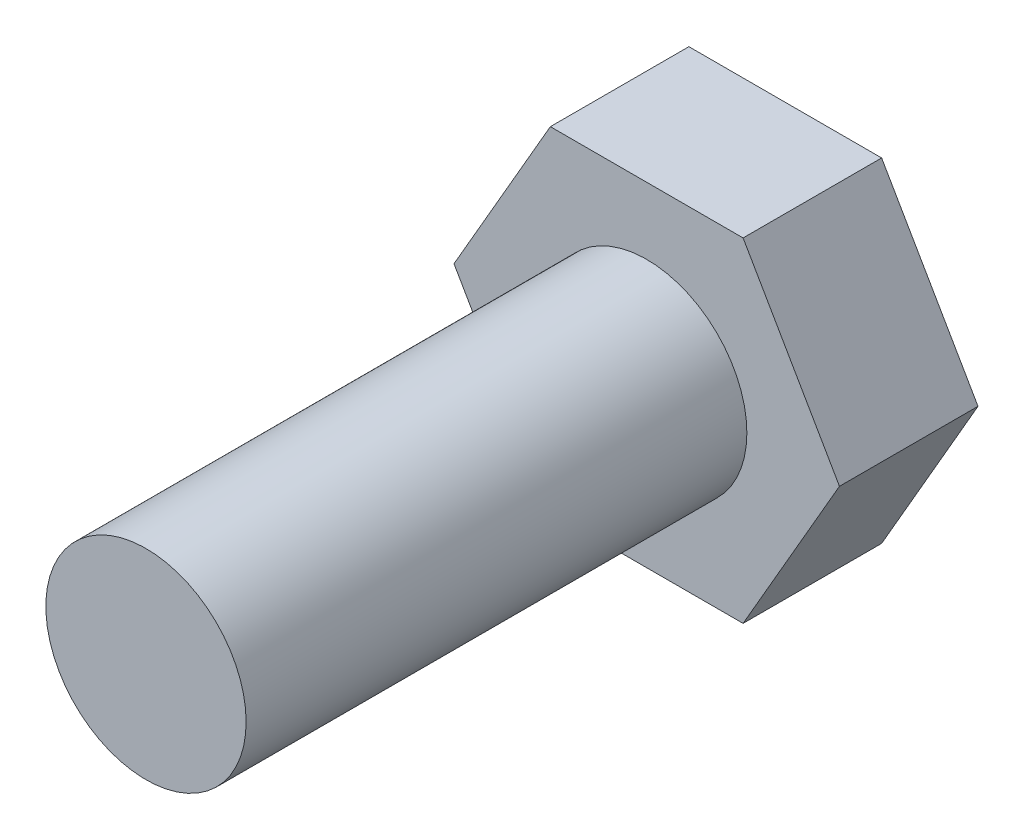
from build123d import *

# Parameters (mm, degrees)
BOSS_EXTRUDE1_DEPTH = 4.15
SKETCH2_R           = 3
BOSS_EXTRUDE2_DEPTH = 15


with BuildPart() as part:
    # Sketch1 → Boss-Extrude1 (new body)
    with BuildSketch(Plane.XY):
        Polygon((-2.886751346, 5), (-5.773502692, 0), (-2.886751346, -5), (2.886751346, -5), (5.773502692, 0), (2.886751346, 5), align=None)
    extrude(amount=BOSS_EXTRUDE1_DEPTH)

    # Sketch2 → Boss-Extrude2 (add)
    with BuildSketch(Plane.XY.offset(4.15)):
        Circle(SKETCH2_R)
    extrude(amount=BOSS_EXTRUDE2_DEPTH)


solid = part.part
